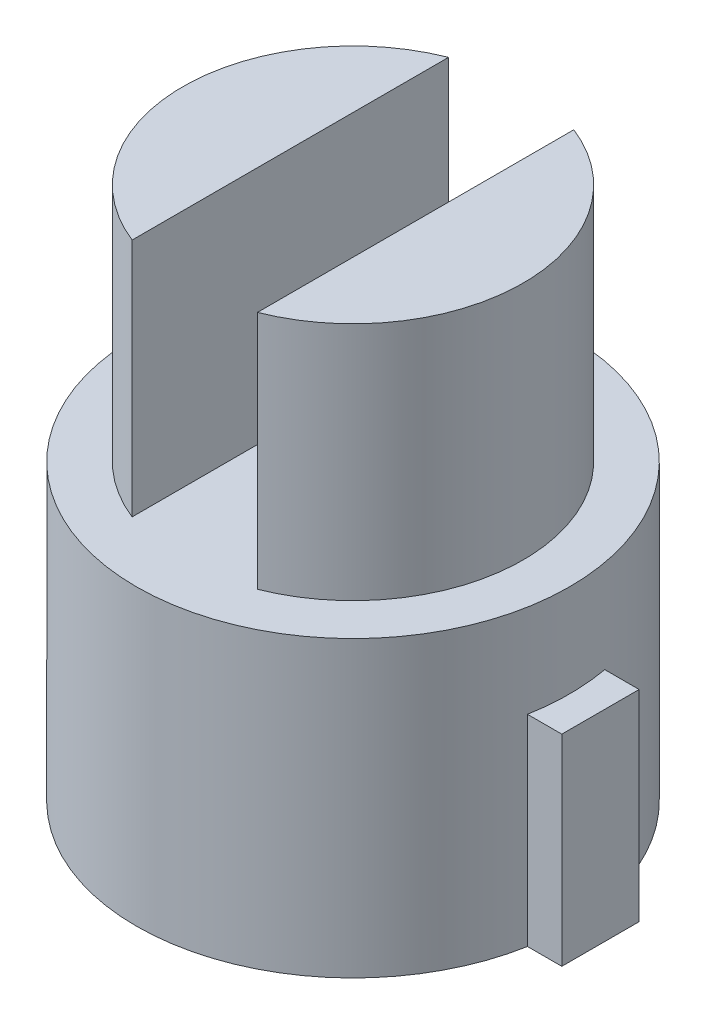
from build123d import *

# Parameters (mm, degrees)
BOSS_EXTRUDE1_DEPTH   = 34.5
BOSS_EXTRUDE1_2_DEPTH = 34.5
SKETCH1_4_R           = 14
BOSS_EXTRUDE2_DEPTH   = 19
BOSS_EXTRUDE3_DEPTH   = 13


with BuildPart() as part:
    # Sketch1 → Boss-Extrude1 (new body)
    with BuildSketch(Plane(origin=(0, 0, 0), x_dir=(1, 0, 0), z_dir=(0, 1, 0))):
        with BuildLine():
            Line((-4.053189053, -10.226028173), (-4.050853741, -10.220136277))
            Line((-4.050853741, -10.220136277), (-4.050853741, 10.226953489))
            ThreePointArc((-4.050853741, 10.226953489), (-10.999999641, 0.001255975), (-4.053189053, -10.226028173))
        make_face()
    extrude(amount=BOSS_EXTRUDE1_DEPTH)



with BuildPart() as body_2:
    # Sketch1 → Boss-Extrude1 2 (new body)
    with BuildSketch(Plane(origin=(0, 0, 0), x_dir=(1, 0, 0), z_dir=(0, 1, 0))):
        with BuildLine():
            ThreePointArc((4.050853741, -10.226953489), (10.999999713, 0), (4.050853741, 10.226953489))
            Line((4.050853741, 10.226953489), (4.050853741, -10.226953489))
        make_face()
    extrude(amount=BOSS_EXTRUDE1_2_DEPTH)


with BuildPart() as part_1:
    add(part.part)

    add(body_2.part)  # Boss-Extrude2 merges body 2
    # Sketch1<4> → Boss-Extrude2 (add)
    with BuildSketch(Plane(origin=(0, 0, 0), x_dir=(1, 0, 0), z_dir=(0, 1, 0))):
        Circle(SKETCH1_4_R)
        with BuildLine():
            Line((-4.050853741, -10.220136277), (-4.050853741, -10.226953489))
            ThreePointArc((-4.050853741, -10.226953489), (-10.999999713, 0), (-4.050853741, 10.226953489))
            Line((-4.050853741, 10.226953489), (-4.050853741, 2.501755217))
            Line((-4.050853741, 2.501755217), (-4.050853741, -10.220136277))
        make_face(mode=Mode.SUBTRACT)
        with BuildLine():
            Line((4.050853741, -10.226953489), (4.050853741, 2.5))
            Line((4.050853741, 2.5), (4.050853741, 10.226953489))
            ThreePointArc((4.050853741, 10.226953489), (10.999999713, 0), (4.050853741, -10.226953489))
        make_face(mode=Mode.SUBTRACT)
    extrude(amount=BOSS_EXTRUDE2_DEPTH)

    # Sketch1<5> → Boss-Extrude3 (add)
    with BuildSketch(Plane(origin=(0, 0, 0), x_dir=(1, 0, 0), z_dir=(0, 1, 0))):
        with BuildLine():
            Line((-16, -2.498244783), (-13.77529575, -2.498244783))
            ThreePointArc((-13.77529575, -2.498244783), (-13.999999886, 0.001783889), (-13.774658647, 2.501755217))
            Line((-13.774658647, 2.501755217), (-16, 2.501755217))
            Line((-16, 2.501755217), (-16, -2.498244783))
        make_face()
        with BuildLine():
            ThreePointArc((13.774977314, 2.5), (13.999999972, 0.000891934), (13.77529575, -2.498244783))
            Line((13.77529575, -2.498244783), (15.995322261, -2.498244783))
            Line((15.995322261, -2.498244783), (15.995322261, 2.5))
            Line((15.995322261, 2.5), (13.774977314, 2.5))
        make_face()
    extrude(amount=BOSS_EXTRUDE3_DEPTH)


solid = part_1.part
